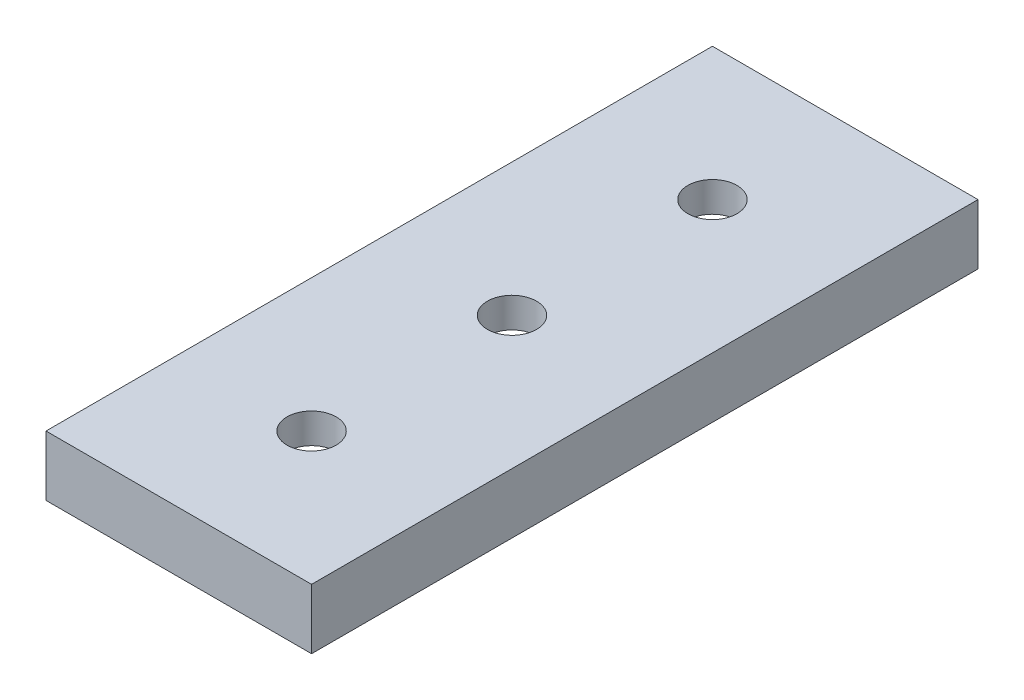
from build123d import *

# Parameters (mm, degrees)
SKETCH1_W           = 20.5
SKETCH1_H           = 60.5
SKETCH1_R           = 2.45
BOSS_EXTRUDE1_DEPTH = 3
SKETCH2_W           = 26.5
SKETCH2_H           = 66.5
SKETCH2_W_2         = 20.5
SKETCH2_H_2         = 60.5
BOSS_EXTRUDE2_DEPTH = 6


with BuildPart() as part:
    # Sketch1 → Boss-Extrude1 (new body)
    with BuildSketch(Plane(origin=(0, 0, 0), x_dir=(1, 0, 0), z_dir=(0, 1, 0))):
        with Locations((10.25, 30.25)):
            Rectangle(SKETCH1_W, SKETCH1_H)
        with Locations(Location((10.25, 10.25, 0), (0, 0, 270))):
            Circle(SKETCH1_R, mode=Mode.SUBTRACT)
        with Locations(Location((10.25, 50.25, 0), (0, 0, 270))):
            Circle(SKETCH1_R, mode=Mode.SUBTRACT)
        with Locations(Location((10.25, 30.25, 0), (0, 0, 270))):
            Circle(SKETCH1_R, mode=Mode.SUBTRACT)
    extrude(amount=BOSS_EXTRUDE1_DEPTH)

    # Sketch2 → Boss-Extrude2 (add)
    with BuildSketch(Plane(origin=(0, 3, 0), x_dir=(1, 0, 0), z_dir=(0, 1, 0))):
        with Locations((10.25, 30.25)):
            Rectangle(SKETCH2_W, SKETCH2_H)
        with Locations((10.25, 30.25)):
            Rectangle(SKETCH2_W_2, SKETCH2_H_2, mode=Mode.SUBTRACT)
    extrude(amount=-BOSS_EXTRUDE2_DEPTH)


solid = part.part
